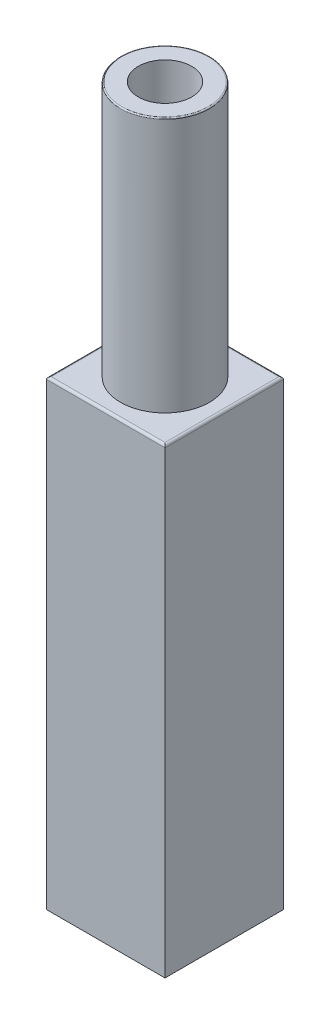
from build123d import *

# Parameters (mm, degrees)
BOSS_EXTRUDE2_DEPTH      = 150
BOSS_EXTRUDE2_DEPTH_BACK = 239.246198725
SKETCH1_W                = 100
SKETCH1_H                = 100
SKETCH1_4_R              = 37.5
SKETCH1_4_R_2            = 22.5
BOSS_EXTRUDE3_DEPTH      = 365.528532985
SKETCH1_5_R              = 22.5
CUT_EXTRUDE1_DEPTH       = 215
FILLET2_R                = 2
FILLET3_R                = 1


with BuildPart() as part:
    # Sketch1 → Boss-Extrude2 (new, two sides: drawn at the far end of the back side and taken through both)
    with BuildSketch(Plane(origin=(0, 0, 0), x_dir=(1, 0, 0), z_dir=(0, 1, 0)).offset(-BOSS_EXTRUDE2_DEPTH_BACK)):
        Rectangle(SKETCH1_W, SKETCH1_H)
    extrude(amount=BOSS_EXTRUDE2_DEPTH + BOSS_EXTRUDE2_DEPTH_BACK)

    # Sketch1<5> → Cut-Extrude1 (cut)
    with BuildSketch(Plane(origin=(0, 0, 0), x_dir=(1, 0, 0), z_dir=(0, 1, 0))):
        Circle(SKETCH1_5_R)
    extrude(amount=CUT_EXTRUDE1_DEPTH, mode=Mode.SUBTRACT)

    # Fillet2
    fillet2_edges = [part.edges().sort_by_distance(p)[0] for p in [
        (-50, 150, 0),
        (0, 150, 50),
        (50, 150, 0),
        (0, 150, -50),
    ]]
    fillet(fillet2_edges, radius=FILLET2_R)


with BuildPart() as body_2:
    # Sketch1<4> → Boss-Extrude3 (new body)
    with BuildSketch(Plane(origin=(0, 0, 0), x_dir=(1, 0, 0), z_dir=(0, 1, 0))):
        Circle(SKETCH1_4_R)
        Circle(SKETCH1_4_R_2, mode=Mode.SUBTRACT)
    extrude(amount=BOSS_EXTRUDE3_DEPTH)

    # Fillet3
    fillet3_edges = [body_2.edges().sort_by_distance(p)[0] for p in [
        (-37.5, 365.528532985, 0),
    ]]
    fillet(fillet3_edges, radius=FILLET3_R)


solid = Compound([part.part, body_2.part])
